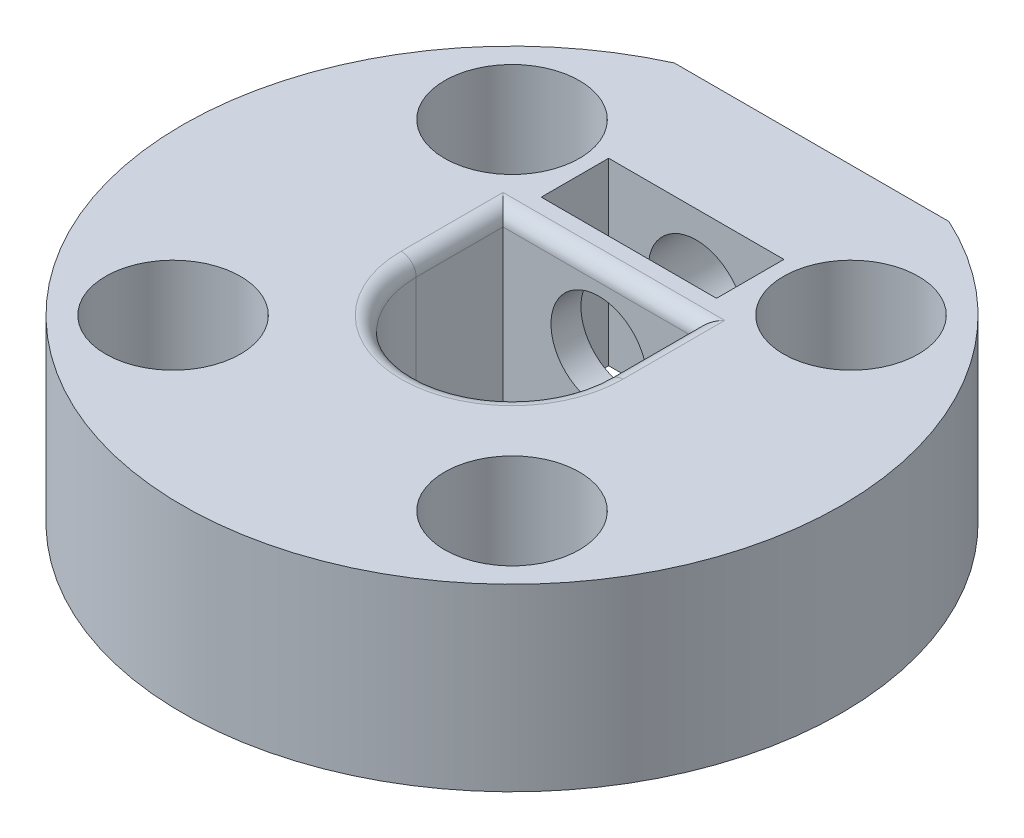
from build123d import *

# Parameters (mm, degrees)
BOSS_EXTRU_1_DEPTH                              = 6
CHAMBRAGE_POUR_VIS_T_TE_CYLINDRIQUE_D           = 2.5
CHAMBRAGE_POUR_VIS_T_TE_CYLINDRIQUE_CBORE_D     = 4.5
CHAMBRAGE_POUR_VIS_T_TE_CYLINDRIQUE_CBORE_DEPTH = 4.5
CONG_1_R                                        = 0.5
ESQUISSE6_R                                     = 1.6
ENL_V_MAT_EXTRU_1_DEPTH                         = 17.673332037
ESQUISSE7_W                                     = 5.85
ESQUISSE7_H                                     = 2.25
ENL_V_MAT_EXTRU_2_DEPTH                         = 17.673332001


with BuildPart() as part:
    # Esquisse1 → Boss.-Extru.1 (new body)
    with BuildSketch(Plane(origin=(0, 0, 0), x_dir=(1, 0, 0), z_dir=(0, 1, 0))):
        with BuildLine():
            Line((4.582575695, 10), (-4.582575695, 10))
            ThreePointArc((-4.582575695, 10), (0, -11), (4.582575695, 10))
        make_face()
        with BuildLine():
            Line((-3.2, 0), (-3.2, 2.9))
            Line((-3.2, 2.9), (3.2, 2.9))
            Line((3.2, 2.9), (3.2, 0))
            ThreePointArc((3.2, 0), (0, -3.2), (-3.2, 0))
        make_face(mode=Mode.SUBTRACT)
    extrude(amount=BOSS_EXTRU_1_DEPTH)

    # Chambrage pour vis à tête cylindrique à 6 pans creux (ou vis CHC) M21 (through all)
    with Locations(Plane(origin=(0, 6, 0), x_dir=(1, 0, 0), z_dir=(0, 1, 0))):
        with Locations((5.656854249, 5.656854249), (5.656854249, -5.656854249), (-5.656854249, -5.656854249), (-5.656854249, 5.656854249), (0, 0)):
            CounterBoreHole(CHAMBRAGE_POUR_VIS_T_TE_CYLINDRIQUE_D / 2, CHAMBRAGE_POUR_VIS_T_TE_CYLINDRIQUE_CBORE_D / 2, CHAMBRAGE_POUR_VIS_T_TE_CYLINDRIQUE_CBORE_DEPTH)

    # Congé1
    cong_1_edges = [part.edges().sort_by_distance(p)[0] for p in [
        (0, 6, 3.2),
        (3.2, 6, -1.45),
        (0, 6, -2.9),
        (-3.2, 6, -1.45),
    ]]
    fillet(cong_1_edges, radius=CONG_1_R)

    # Esquisse6 → Enlèv. mat.-Extru.1 (cut, through all)
    with BuildSketch(Plane.XY):
        with Locations((0, 3.5)):
            Circle(ESQUISSE6_R)
    extrude(amount=-ENL_V_MAT_EXTRU_1_DEPTH, mode=Mode.SUBTRACT)

    # Esquisse7 → Enlèv. mat.-Extru.2 (cut, through all)
    with BuildSketch(Plane(origin=(0, 6, 0), x_dir=(1, 0, 0), z_dir=(0, 1, 0))):
        with Locations((0, 5.025)):
            Rectangle(ESQUISSE7_W, ESQUISSE7_H)
    extrude(amount=-ENL_V_MAT_EXTRU_2_DEPTH, mode=Mode.SUBTRACT)


solid = part.part
